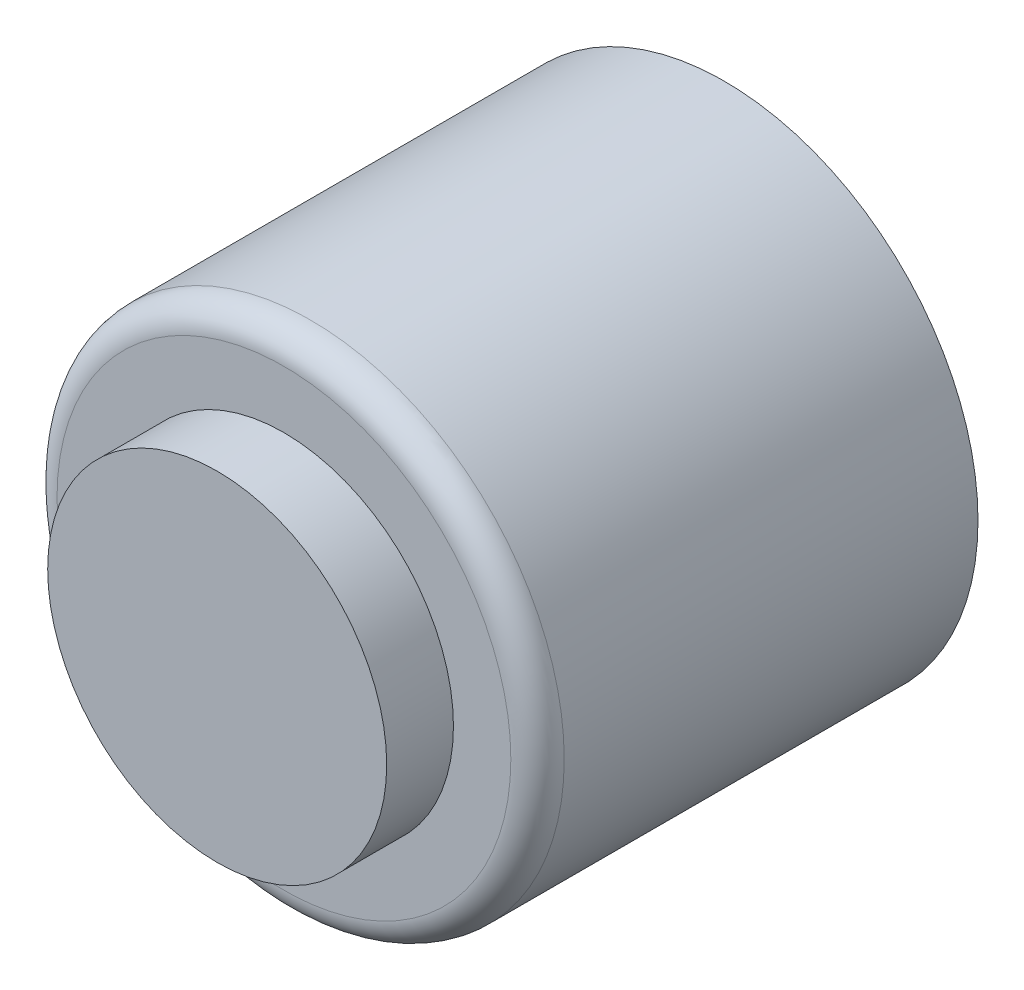
from build123d import *

# Parameters (mm, degrees)
FILLET1_R = 2


with BuildPart() as part:
    # Sketch1 → Revolve1 (revolve)
    with BuildSketch(Plane(origin=(0, 0, 0), x_dir=(0, 0, -1), z_dir=(1, 0, 0)), mode=Mode.PRIVATE) as revolve1_sk:
        with BuildLine():
            Line((0, 0), (0, -12.7))
            Line((0, -12.7), (5, -12.7))
            Line((5, -12.7), (5, -19))
            Line((5, -19), (38, -19))
            Line((38, -19), (38, -18))
            Line((38, -18), (34.517434791, -14.517434791))
            ThreePointArc((34.517434791, -14.517434791), (37.117181053, -7.464652928), (38, 0))
            Line((38, 0), (6, 0))
            Line((6, 0), (0, 0))
        make_face()
    revolve(revolve1_sk.sketch.rotate(Axis((0, 0, 0), (0, 0, -1)), 270), axis=Axis((0, 0, 0), (0, 0, -1)))

    # Fillet1
    fillet1_edges = [part.edges().sort_by_distance(p)[0] for p in [
        (-19, 0, -5),
    ]]
    fillet(fillet1_edges, radius=FILLET1_R)


solid = part.part
